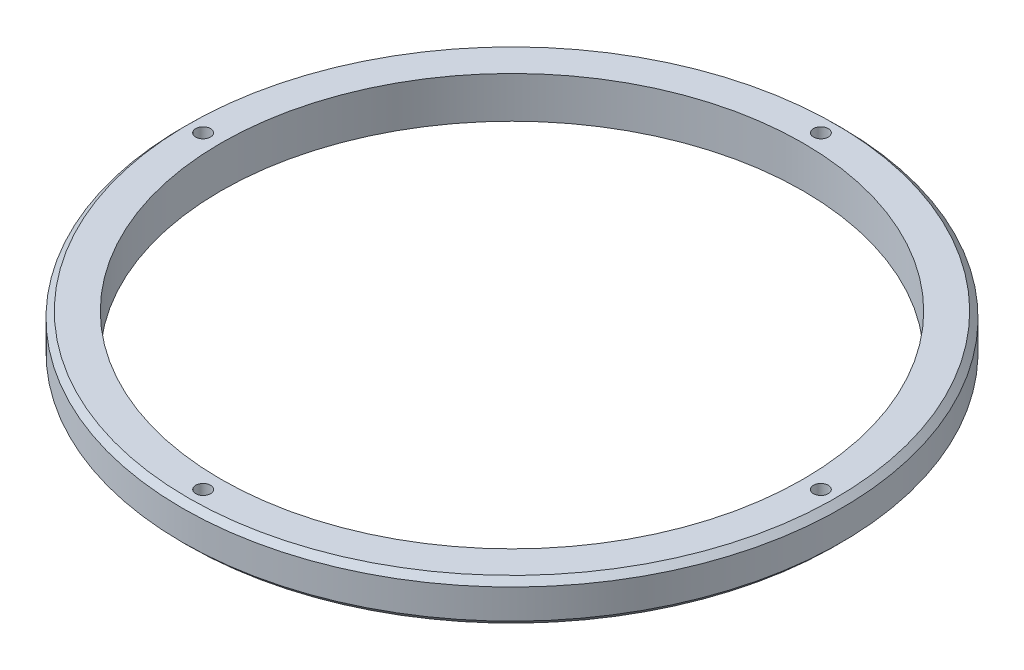
from build123d import *

# Parameters (mm, degrees)
SKETCH1_R           = 111.5
SKETCH1_R_2         = 98.5
SKETCH1_R_3         = 2.5
BOSS_EXTRUDE1_DEPTH = 14
CHAMFER1_SIZE       = 2


with BuildPart() as part:
    # Sketch1 → Boss-Extrude1 (new body)
    with BuildSketch(Plane(origin=(0, 0, 0), x_dir=(1, 0, 0), z_dir=(0, 1, 0))):
        with Locations(Location((0, 0, 0), (0, 0, 270))):
            Circle(SKETCH1_R)
        with Locations(Location((0, 0, 0), (0, 0, 270))):
            Circle(SKETCH1_R_2, mode=Mode.SUBTRACT)
        with Locations(Location((0, 104.5, 0), (0, 0, 270))):
            Circle(SKETCH1_R_3, mode=Mode.SUBTRACT)
        with Locations(Location((104.5, 0, 0), (0, 0, 270))):
            Circle(SKETCH1_R_3, mode=Mode.SUBTRACT)
        with Locations(Location((0, -104.5, 0), (0, 0, 270))):
            Circle(SKETCH1_R_3, mode=Mode.SUBTRACT)
        with Locations(Location((-104.5, 0, 0), (0, 0, 270))):
            Circle(SKETCH1_R_3, mode=Mode.SUBTRACT)
    extrude(amount=BOSS_EXTRUDE1_DEPTH)

    # Chamfer1
    chamfer1_edges = [part.edges().sort_by_distance(p)[0] for p in [
        (0, 0, -111.5),
        (0, 14, -111.5),
    ]]
    chamfer(chamfer1_edges, length=CHAMFER1_SIZE)


solid = part.part
